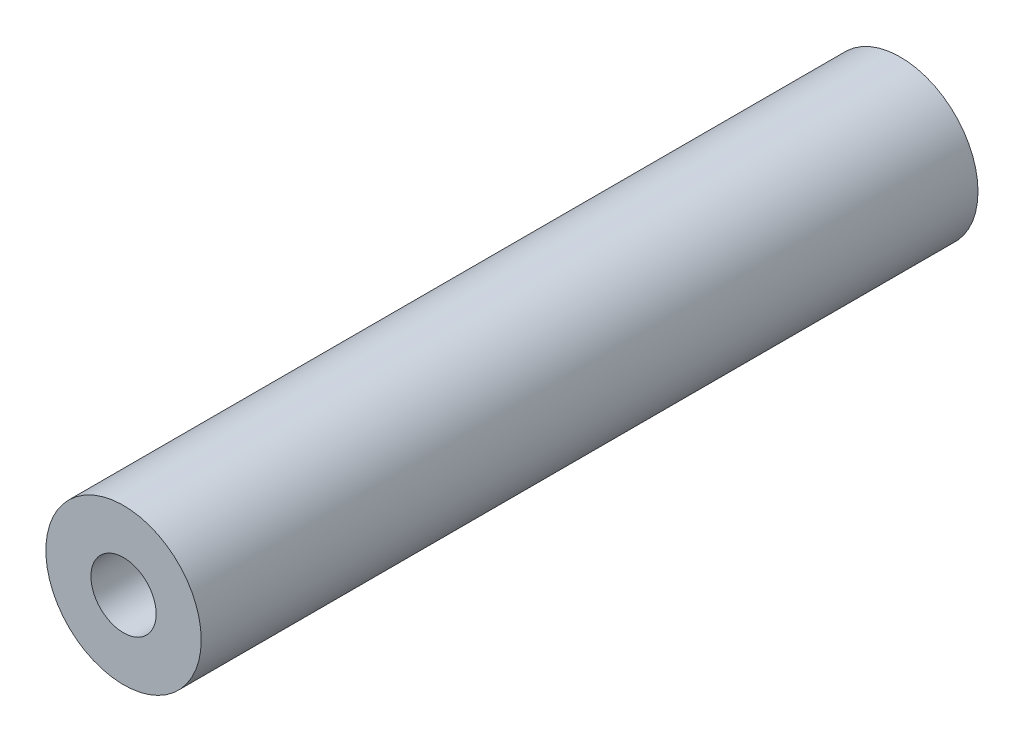
from build123d import *

# Parameters (mm, degrees)
SKETCH_1_R      = 5
EXTRUDE_1_DEPTH = 50
M5X0_81_D       = 4.2


with BuildPart() as part:
    # Эскиз1 → Бобышка-Вытянуть1 (new body)
    with BuildSketch(Plane.XY):
        Circle(SKETCH_1_R)
    extrude(amount=EXTRUDE_1_DEPTH)

    # Отверстие обработанное метчиком M5x0.81 (through all)
    with Locations(Plane.XY.offset(50)):
        with Locations((0, 0)):
            Hole(M5X0_81_D / 2)


solid = part.part
